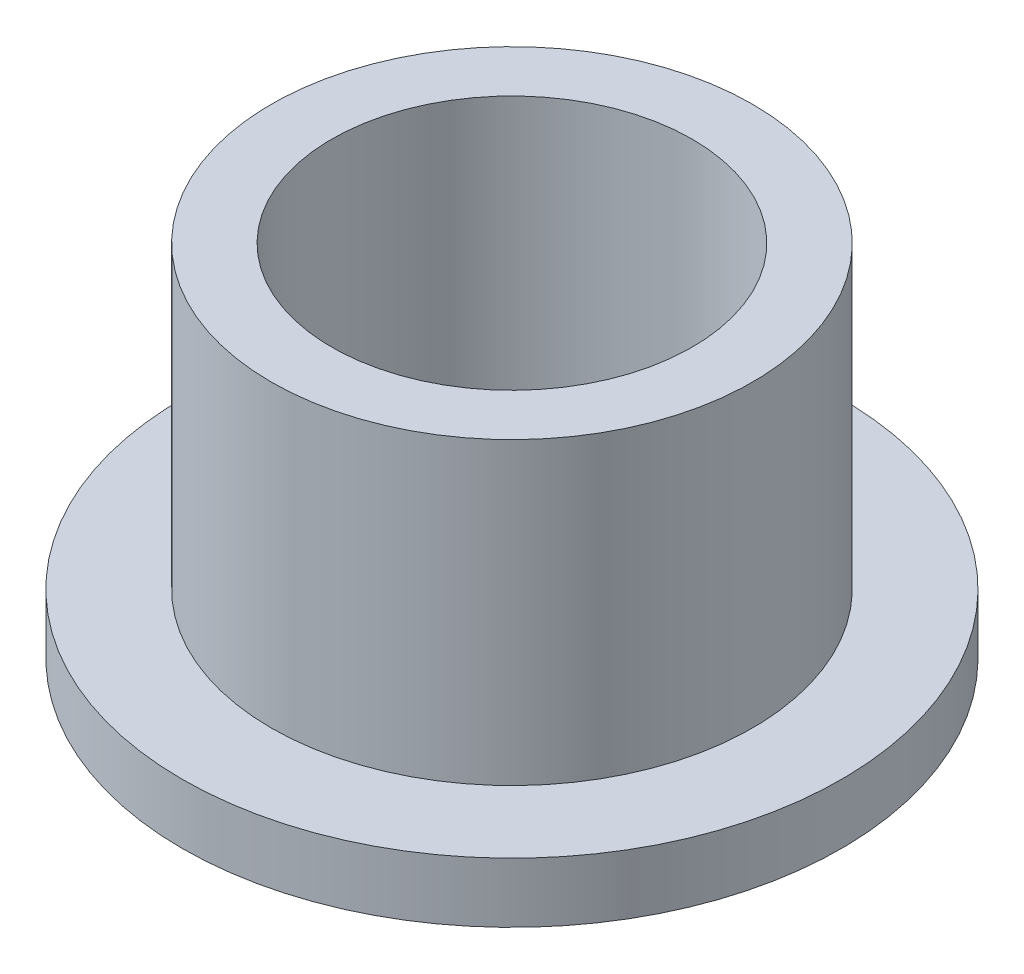
from build123d import *

# Parameters (mm, degrees)
SKETCH2_R           = 6.3754
SKETCH2_R_2         = 4.7752
BOSS_EXTRUDE1_DEPTH = 9.525
SKETCH3_R           = 8.73125
SKETCH3_R_2         = 6.3754
BOSS_EXTRUDE2_DEPTH = 1.5875


with BuildPart() as part:
    # Sketch2 → Boss-Extrude1 (new body)
    with BuildSketch(Plane(origin=(0, 0, 0), x_dir=(1, 0, 0), z_dir=(0, 1, 0))):
        with Locations(Location((0, 0, 0), (0, 0, 90))):
            Circle(SKETCH2_R)
        with Locations(Location((0, 0, 0), (0, 0, 90))):
            Circle(SKETCH2_R_2, mode=Mode.SUBTRACT)
    extrude(amount=BOSS_EXTRUDE1_DEPTH)

    # Sketch3 → Boss-Extrude2 (add)
    with BuildSketch(Plane(origin=(0, 0, 0), x_dir=(1, 0, 0), z_dir=(0, 1, 0))):
        with Locations(Location((0, 0, 0), (0, 0, 270))):
            Circle(SKETCH3_R)
        with Locations(Location((0, 0, 0), (0, 0, 90))):
            Circle(SKETCH3_R_2, mode=Mode.SUBTRACT)
    extrude(amount=BOSS_EXTRUDE2_DEPTH)


solid = part.part
